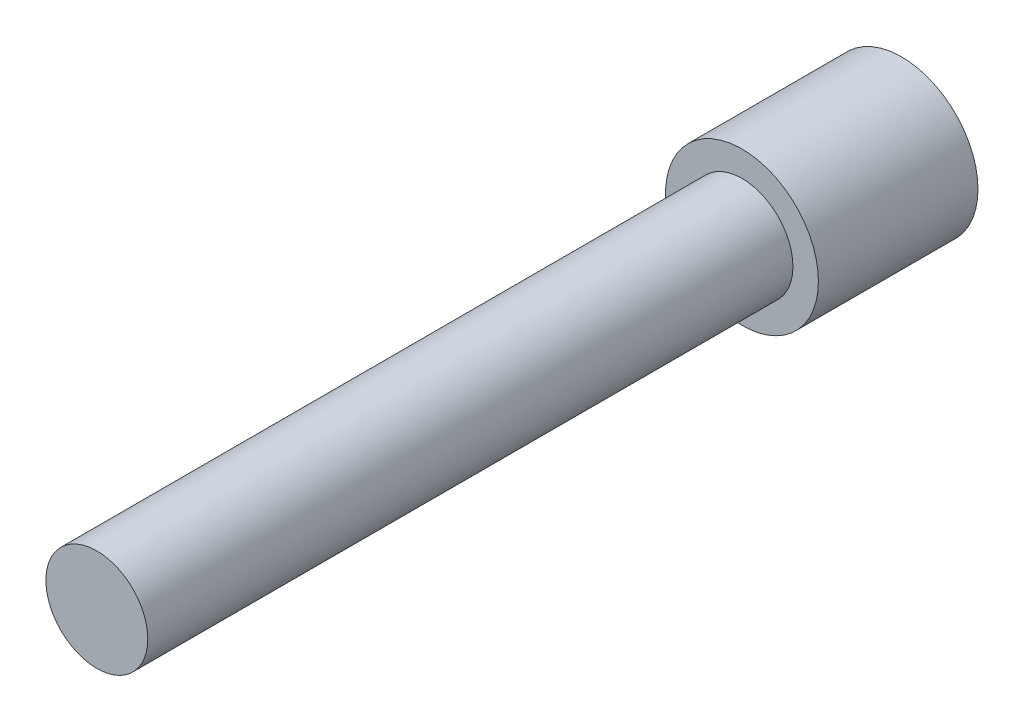
from build123d import *

# Parameters (mm, degrees)
SKETCH1_R           = 2.25
BOSS_EXTRUDE1_DEPTH = 4.7
SKETCH2_R           = 1.5
BOSS_EXTRUDE2_DEPTH = 19
SKETCH3_R           = 1.5
CUT_EXTRUDE1_DEPTH  = 3


with BuildPart() as part:
    # Sketch1 → Boss-Extrude1 (new body)
    with BuildSketch(Plane.XY):
        Circle(SKETCH1_R)
    extrude(amount=BOSS_EXTRUDE1_DEPTH)

    # Sketch2 → Boss-Extrude2 (add)
    with BuildSketch(Plane.XY.offset(4.7)):
        Circle(SKETCH2_R)
    extrude(amount=BOSS_EXTRUDE2_DEPTH)

    # Sketch3 → Cut-Extrude1 (cut)
    with BuildSketch(Plane(origin=(0, 0, 0), x_dir=(-1, 0, 0), z_dir=(0, 0, -1))):
        with Locations(Location((0, 0, 0), (0, 0, 180))):
            Circle(SKETCH3_R)
    extrude(amount=-CUT_EXTRUDE1_DEPTH, mode=Mode.SUBTRACT)


solid = part.part
